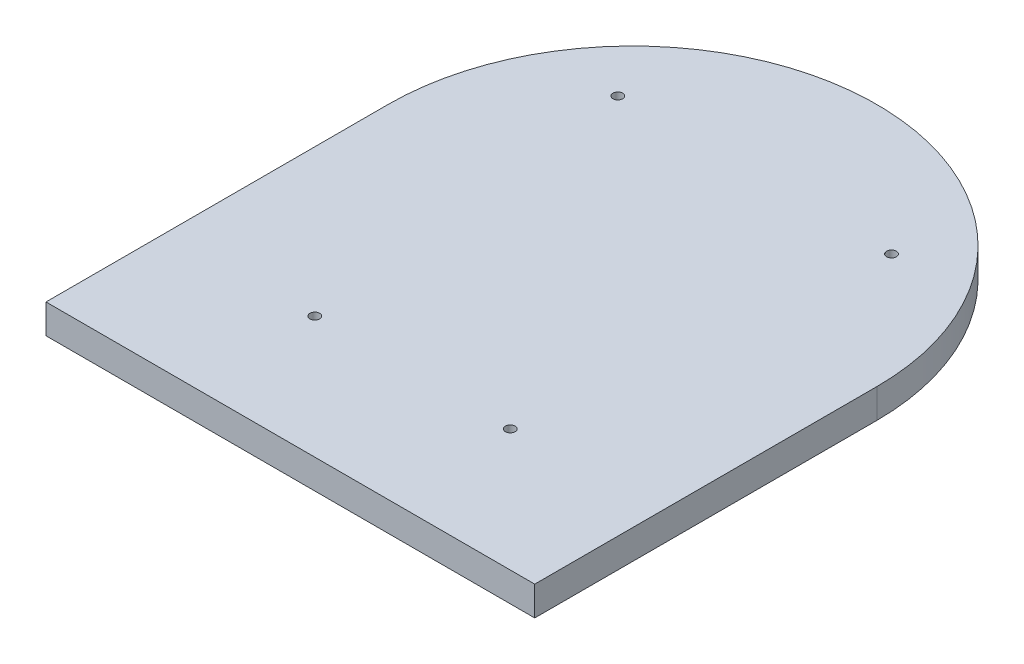
from build123d import *

# Parameters (mm, degrees)
SKETCH1_R           = 1
BOSS_EXTRUDE1_DEPTH = 6


with BuildPart() as part:
    # Sketch1 → Boss-Extrude1 (new body)
    with BuildSketch(Plane(origin=(0, 0, 0), x_dir=(1, 0, 0), z_dir=(0, 1, 0))):
        with BuildLine():
            Line((0, 0), (100, 0))
            Line((100, 0), (100, 70))
            ThreePointArc((100, 70), (50, 120), (0, 70))
            Line((0, 70), (0, 0))
        make_face()
        with Locations(Location((22, 95, 0), (0, 0, 270))):
            Circle(SKETCH1_R, mode=Mode.SUBTRACT)
        with Locations(Location((78, 95, 0), (0, 0, 270))):
            Circle(SKETCH1_R, mode=Mode.SUBTRACT)
        with Locations(Location((30, 25, 0), (0, 0, 270))):
            Circle(SKETCH1_R, mode=Mode.SUBTRACT)
        with Locations(Location((70, 25, 0), (0, 0, 270))):
            Circle(SKETCH1_R, mode=Mode.SUBTRACT)
    extrude(amount=BOSS_EXTRUDE1_DEPTH)


solid = part.part
